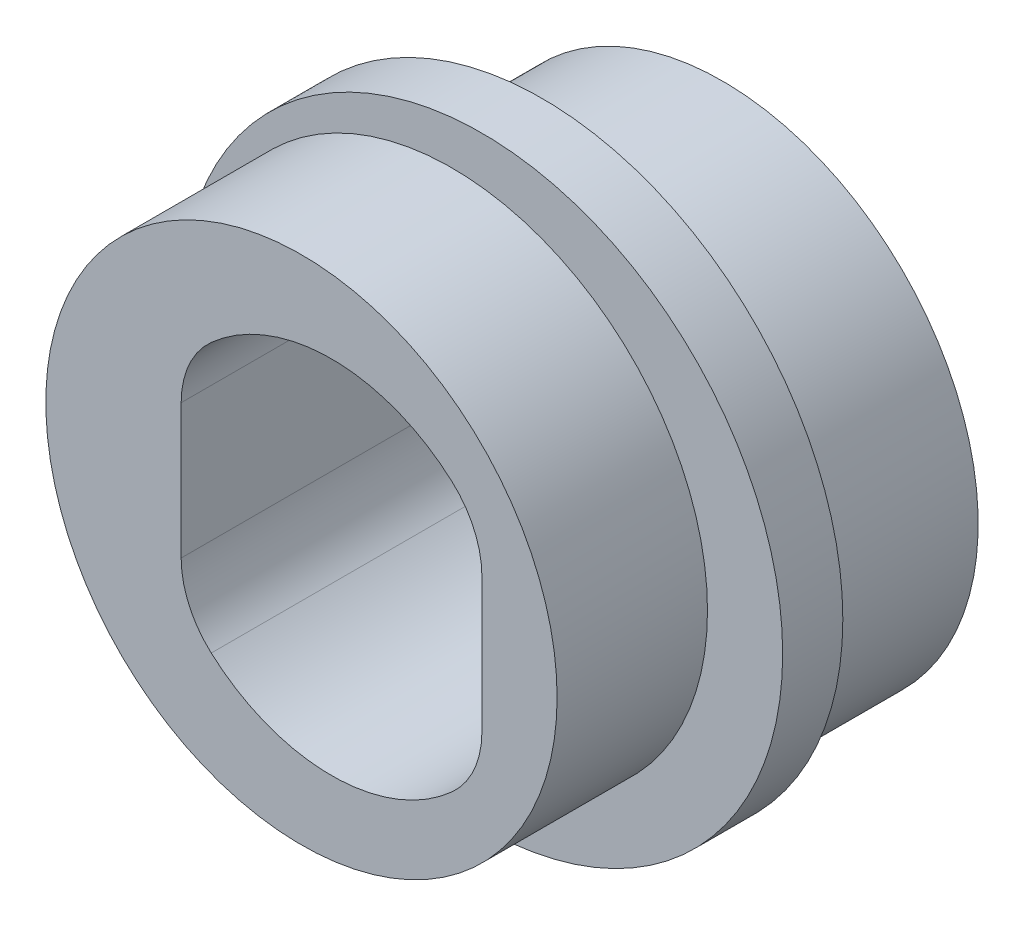
from build123d import *

# Parameters (mm, degrees)
SKETCH1_R           = 8.5
BOSS_EXTRUDE1_DEPTH = 5
SKETCH2_R           = 8.5
BOSS_EXTRUDE2_DEPTH = 7
CUT_EXTRUDE1_DEPTH  = 15.543039572
BOSS_EXTRUDE3_START = 2
SKETCH4_R           = 10
BOSS_EXTRUDE3_DEPTH = 2
FILLET2_R           = 3


with BuildPart() as part:
    # Sketch1 → Boss-Extrude1 (new body)
    with BuildSketch(Plane.XY):
        with Locations((-1, 0)):
            Circle(SKETCH1_R)
        with BuildLine():
            Line((5, -3.31662479), (5, 3.31662479))
            ThreePointArc((5, 3.31662479), (0, 6), (-5, 3.31662479))
            Line((-5, 3.31662479), (-5, -3.31662479))
            ThreePointArc((-5, -3.31662479), (0, -6), (5, -3.31662479))
        make_face(mode=Mode.SUBTRACT)
    extrude(amount=BOSS_EXTRUDE1_DEPTH)

    # Sketch2 → Boss-Extrude2 (add)
    with BuildSketch(Plane(origin=(0, 0, 0), x_dir=(-1, 0, 0), z_dir=(0, 0, -1))):
        with Locations((-1, 0)):
            Circle(SKETCH2_R)
    extrude(amount=BOSS_EXTRUDE2_DEPTH)

    # Sketch3 → Cut-Extrude1 (cut, through all)
    with BuildSketch(Plane.XY):
        with BuildLine():
            Line((5, -3.31662479), (5, 3.31662479))
            ThreePointArc((5, 3.31662479), (0, 6), (-5, 3.31662479))
            Line((-5, 3.31662479), (-5, -3.31662479))
            ThreePointArc((-5, -3.31662479), (0, -6), (5, -3.31662479))
        make_face()
    extrude(amount=-CUT_EXTRUDE1_DEPTH, mode=Mode.SUBTRACT)

    # Sketch4 → Boss-Extrude3 (add)
    with BuildSketch(Plane(origin=(0, 0, 0), x_dir=(-1, 0, 0), z_dir=(0, 0, -1)).offset(BOSS_EXTRUDE3_START)):
        Circle(SKETCH4_R)
        with BuildLine():
            Line((5, 3.31662479), (5, -3.31662479))
            ThreePointArc((5, -3.31662479), (0, -6), (-5, -3.31662479))
            Line((-5, -3.31662479), (-5, 3.31662479))
            ThreePointArc((-5, 3.31662479), (0, 6), (5, 3.31662479))
        make_face(mode=Mode.SUBTRACT)
    extrude(amount=-BOSS_EXTRUDE3_DEPTH)

    # Fillet2
    fillet2_edges = [part.edges().sort_by_distance(p)[0] for p in [
        (5, 3.31662479, -1),
        (5, -3.31662479, -1),
        (-5, -3.31662479, -1),
        (-5, 3.31662479, -1),
    ]]
    fillet(fillet2_edges, radius=FILLET2_R)


solid = part.part
